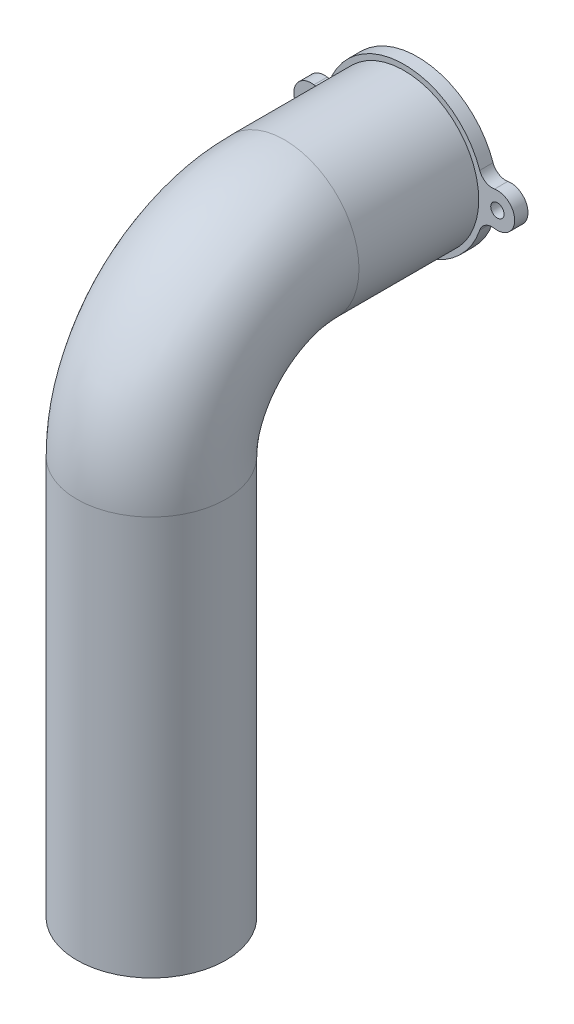
from build123d import *
from build123d.topology import SkipClean

# Parameters (mm, degrees)
SKETCH1_R           = 2.5
BOSS_EXTRUDE1_DEPTH = 5
SKETCH2_R           = 28
SKETCH2_R_2         = 26


with BuildPart() as part:
    # Sketch1 → Boss-Extrude1 (new body)
    with BuildSketch(Plane.XY):
        with BuildLine():
            Line((0, 30), (0, 26))
            ThreePointArc((0, 26), (-26, 0), (0, -26))
            Line((0, -26), (0, -30))
            ThreePointArc((0, -30), (-17.439949034, -24.410001591), (-28.380612245, -9.723211846))
            ThreePointArc((-28.380612245, -9.723211846), (-30.5492718, -7.049680039), (-33.932142857, -6.411683174))
            ThreePointArc((-33.932142857, -6.411683174), (-41.5, 0), (-33.932142857, 6.411683174))
            ThreePointArc((-33.932142857, 6.411683174), (-30.5492718, 7.049680039), (-28.380612245, 9.723211846))
            ThreePointArc((-28.380612245, 9.723211846), (-17.439949034, 24.410001591), (0, 30))
        make_face()
        with Locations((-35, 0)):
            Circle(SKETCH1_R, mode=Mode.SUBTRACT)
    boss_extrude1 = extrude(amount=BOSS_EXTRUDE1_DEPTH)

    # Mirror1: Boss-Extrude1 across plane
    add(boss_extrude1.mirror(Plane(origin=(0, 30, 5), x_dir=(0, 0, 1), z_dir=(-1, 0, 0))))

    # Sweep1: sweep along a path in Sketch3
    with SkipClean():  # the faces are left unmerged after this step: merging them gives an invalid solid
        with BuildLine(Plane(origin=(0, 0, 0), x_dir=(0, 0, -1), z_dir=(1, 0, 0))) as sweep1_path:
            Line((-5, 0), (-50, 0))
            ThreePointArc((-50, 0), (-85.355339059, -14.644660941), (-100, -50))
            Line((-100, -50), (-100, -200))
        # Sketch2 → Sweep1 (sweep)
        with BuildSketch(Plane.XY.offset(5)):
            Circle(SKETCH2_R)
            Circle(SKETCH2_R_2, mode=Mode.SUBTRACT)
        sweep(path=sweep1_path.line)


solid = part.part
